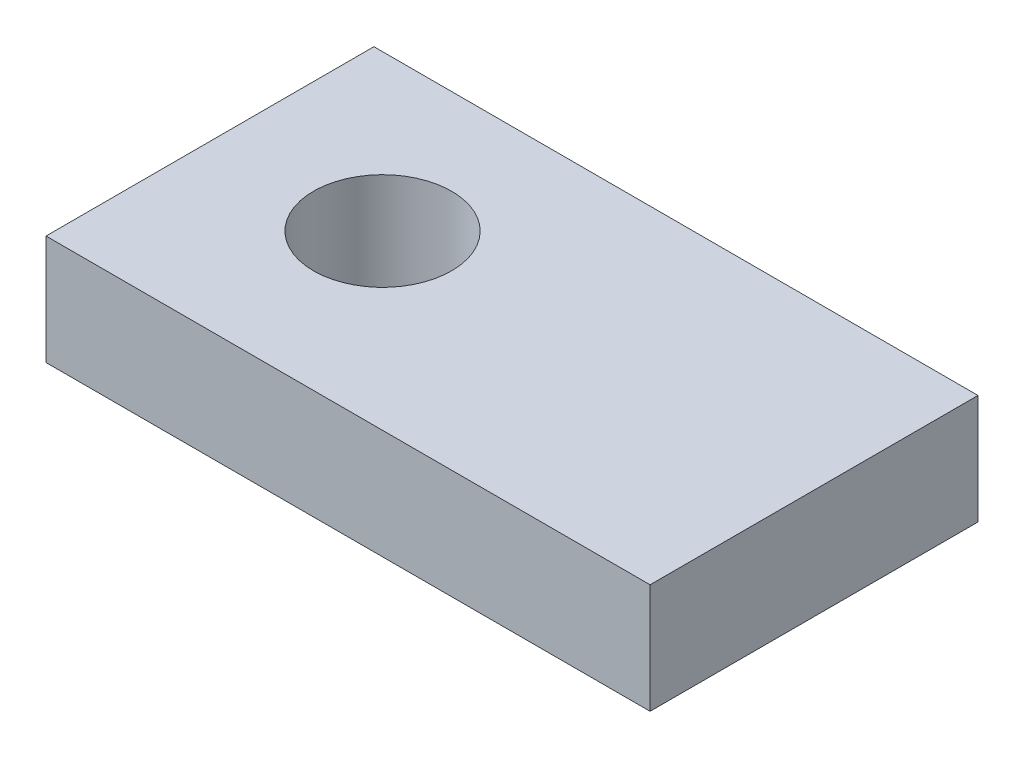
from build123d import *

# Parameters (mm, degrees)
SCHIZZO1_W                   = 35
SCHIZZO1_H                   = 19
SCHIZZO1_R                   = 4
ESTRUSIONE_ESTRUSIONE1_DEPTH = 6.35


with BuildPart() as part:
    # Schizzo1 → Estrusione-Estrusione1 (new body)
    with BuildSketch(Plane(origin=(0, 0, 0), x_dir=(1, 0, 0), z_dir=(0, 1, 0))):
        Rectangle(SCHIZZO1_W, SCHIZZO1_H)
        with Locations(Location((-8, 0.5, 0), (0, 0, 270))):
            Circle(SCHIZZO1_R, mode=Mode.SUBTRACT)
    extrude(amount=ESTRUSIONE_ESTRUSIONE1_DEPTH)


solid = part.part
